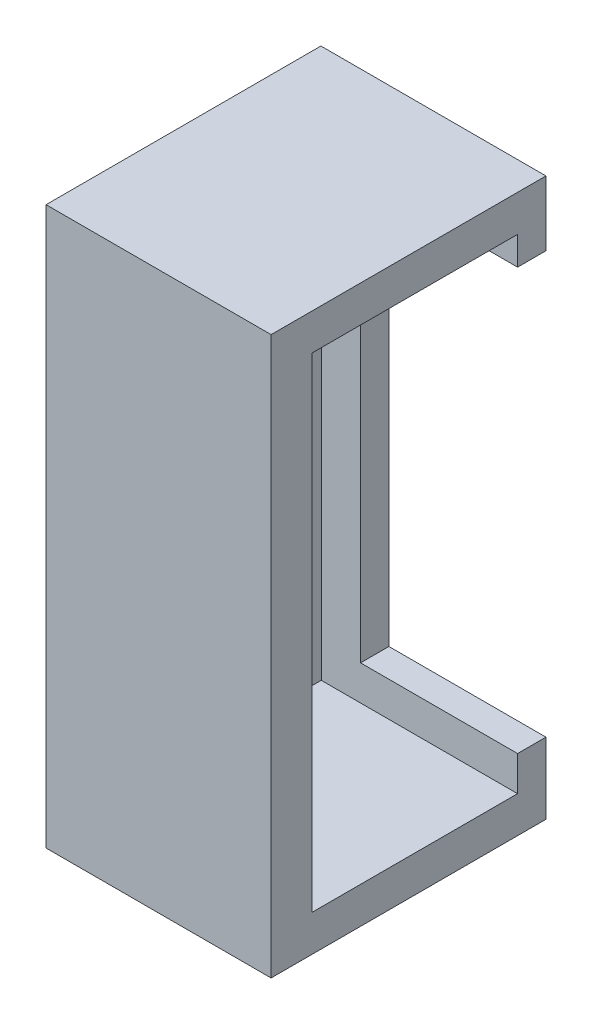
from build123d import *

# Parameters (mm, degrees)
SKETCH_1_W          = 57.317974408
SKETCH_1_H          = 141.917100098
EXTRUDE_1_DEPTH     = 70
SKETCH_2_W          = 52.328757601
SKETCH_2_H          = 123.375109268
CUT_EXTRUDE_1_DEPTH = 50
SKETCH_3_W          = 7.225505581
SKETCH_3_H          = 107.273953083
CUT_EXTRUDE_2_DEPTH = 40


with BuildPart() as part:
    # Эскиз1 → Бобышка-Вытянуть1 (new body)
    with BuildSketch(Plane.XY):
        Rectangle(SKETCH_1_W, SKETCH_1_H)
    extrude(amount=EXTRUDE_1_DEPTH)

    # Эскиз2 → Вырез-Вытянуть1 (cut)
    with BuildSketch(Plane(origin=(28.658987204, 0, 0), x_dir=(0, 0, -1), z_dir=(1, 0, 0))):
        with Locations((-33.389884382, 0)):
            Rectangle(SKETCH_2_W, SKETCH_2_H)
    extrude(amount=-CUT_EXTRUDE_1_DEPTH, mode=Mode.SUBTRACT)

    # Эскиз3 → Вырез-Вытянуть2 (cut)
    with BuildSketch(Plane(origin=(28.658987204, 0, 0), x_dir=(0, 0, -1), z_dir=(1, 0, 0))):
        with Locations((-3.612752791, 0.805057809)):
            Rectangle(SKETCH_3_W, SKETCH_3_H)
    extrude(amount=-CUT_EXTRUDE_2_DEPTH, mode=Mode.SUBTRACT)


solid = part.part
